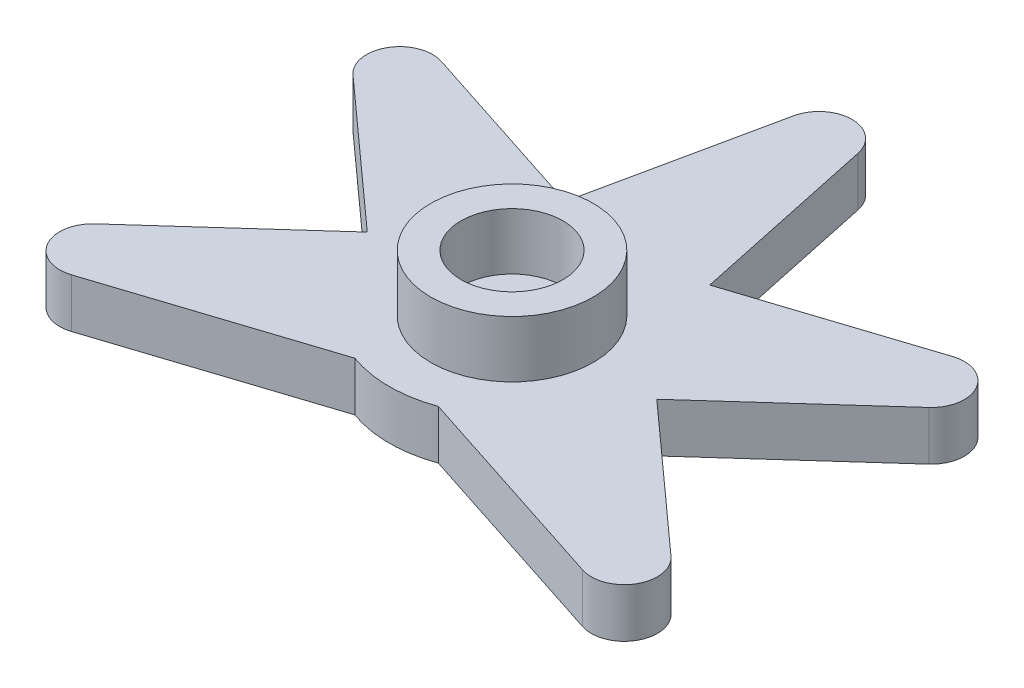
from build123d import *

# Parameters (mm, degrees)
SKETCH1_R           = 1.5
BOSS_EXTRUDE1_DEPTH = 2.6
SKETCH2_R           = 4.3
SKETCH2_R_2         = 2.7
BOSS_EXTRUDE2_DEPTH = 3


with BuildPart() as part:
    # Sketch1 → Boss-Extrude1 (new body)
    with BuildSketch(Plane(origin=(0, 0, 0), x_dir=(1, 0, 0), z_dir=(0, 1, 0))):
        with BuildLine():
            Line((3.832260045, 6.637669106), (1.711758301, 16.613845459))
            ThreePointArc((1.711758301, 16.613845459), (0, 18), (-1.711758301, 16.613845459))
            Line((-1.711758301, 16.613845459), (-3.832260045, 6.637669106))
            Line((-3.832260045, 6.637669106), (-13.532133071, 9.789348904))
            ThreePointArc((-13.532133071, 9.789348904), (-15.588457268, 9), (-15.243891373, 6.824496555))
            Line((-15.243891373, 6.824496555), (-7.664520091, 0))
            Line((-7.664520091, 0), (-15.243891373, -6.824496555))
            ThreePointArc((-15.243891373, -6.824496555), (-15.588457268, -9), (-13.532133071, -9.789348904))
            Line((-13.532133071, -9.789348904), (-2.213204152, -6.111605957))
            ThreePointArc((-2.213204152, -6.111605957), (0, -6.5), (2.213204152, -6.111605957))
            Line((2.213204152, -6.111605957), (13.532133071, -9.789348904))
            ThreePointArc((13.532133071, -9.789348904), (15.588457268, -9), (15.243891373, -6.824496555))
            Line((15.243891373, -6.824496555), (7.664520091, 0))
            Line((7.664520091, 0), (15.243891373, 6.824496555))
            ThreePointArc((15.243891373, 6.824496555), (15.588457268, 9), (13.532133071, 9.789348904))
            Line((13.532133071, 9.789348904), (3.832260045, 6.637669106))
        make_face()
        with Locations(Location((0, 0, 0), (0, 0, 270))):
            Circle(SKETCH1_R, mode=Mode.SUBTRACT)
    extrude(amount=BOSS_EXTRUDE1_DEPTH)

    # Sketch2 → Boss-Extrude2 (add)
    with BuildSketch(Plane(origin=(0, 2.6, 0), x_dir=(1, 0, 0), z_dir=(0, 1, 0))):
        with Locations(Location((0, 0, 0), (0, 0, 270))):
            Circle(SKETCH2_R)
        with Locations(Location((0, 0, 0), (0, 0, 270))):
            Circle(SKETCH2_R_2, mode=Mode.SUBTRACT)
    extrude(amount=BOSS_EXTRUDE2_DEPTH)


solid = part.part
